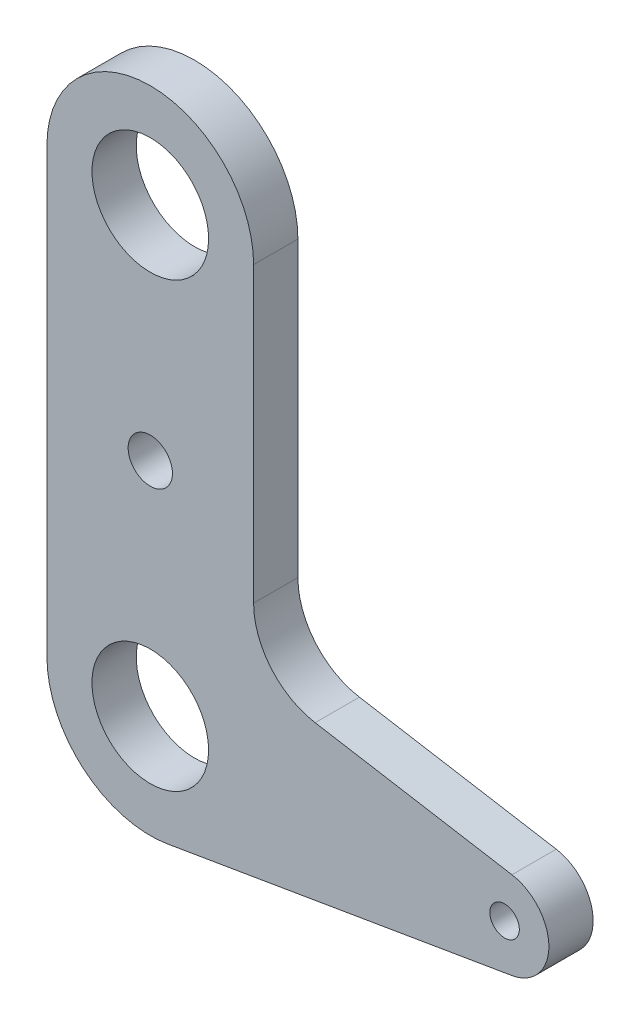
from build123d import *

# Parameters (mm, degrees)
SKETCH_1_R      = 3.95
SKETCH_1_R_2    = 1.5
SKETCH_1_R_3    = 1
EXTRUDE_1_DEPTH = 3
FILLET_1_R      = 5


with BuildPart() as part:
    # 草图1 → 凸台-拉伸1 (new body)
    with BuildSketch(Plane.XY):
        with BuildLine():
            Line((7, 5.916079783), (7, 30))
            ThreePointArc((7, 30), (0, 37), (-7, 30))
            Line((-7, 30), (-7, 0))
            ThreePointArc((-7, 0), (-4.518480571, -5.346338311), (1.166666667, -6.90209308))
            Line((1.166666667, -6.90209308), (24.5, -2.958039892))
            ThreePointArc((24.5, -2.958039892), (27, 0), (24.5, 2.958039892))
            Line((24.5, 2.958039892), (7, 5.916079783))
        make_face()
        Circle(SKETCH_1_R, mode=Mode.SUBTRACT)
        with Locations((0, 15)):
            Circle(SKETCH_1_R_2, mode=Mode.SUBTRACT)
        with Locations((0, 30)):
            Circle(SKETCH_1_R, mode=Mode.SUBTRACT)
        with Locations((24, 0)):
            Circle(SKETCH_1_R_3, mode=Mode.SUBTRACT)
    extrude(amount=EXTRUDE_1_DEPTH)

    # 圆角1
    fillet_1_edges = [part.edges().sort_by_distance(p)[0] for p in [
        (7, 5.916079783, 1.5),
    ]]
    fillet(fillet_1_edges, radius=FILLET_1_R)


solid = part.part
